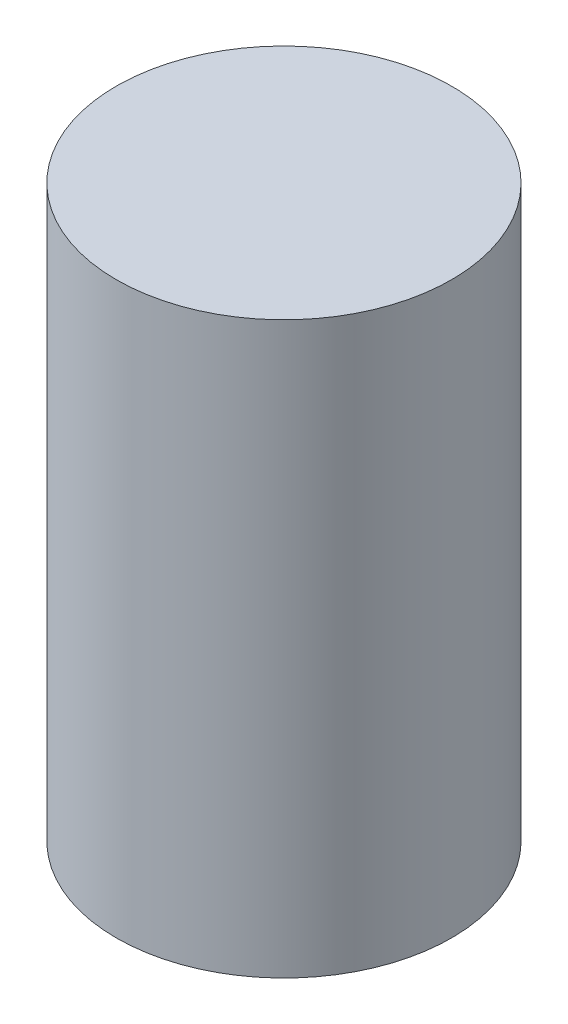
from build123d import *

# Parameters (mm, degrees)
SKETCH1_R           = 15
BOSS_EXTRUDE1_DEPTH = 51


with BuildPart() as part:
    # Sketch1 → Boss-Extrude1 (new body)
    with BuildSketch(Plane(origin=(0, 0, 0), x_dir=(1, 0, 0), z_dir=(0, 1, 0))):
        with Locations(Location((0, 0, 0), (0, 0, 270))):
            Circle(SKETCH1_R)
    extrude(amount=BOSS_EXTRUDE1_DEPTH)


solid = part.part
